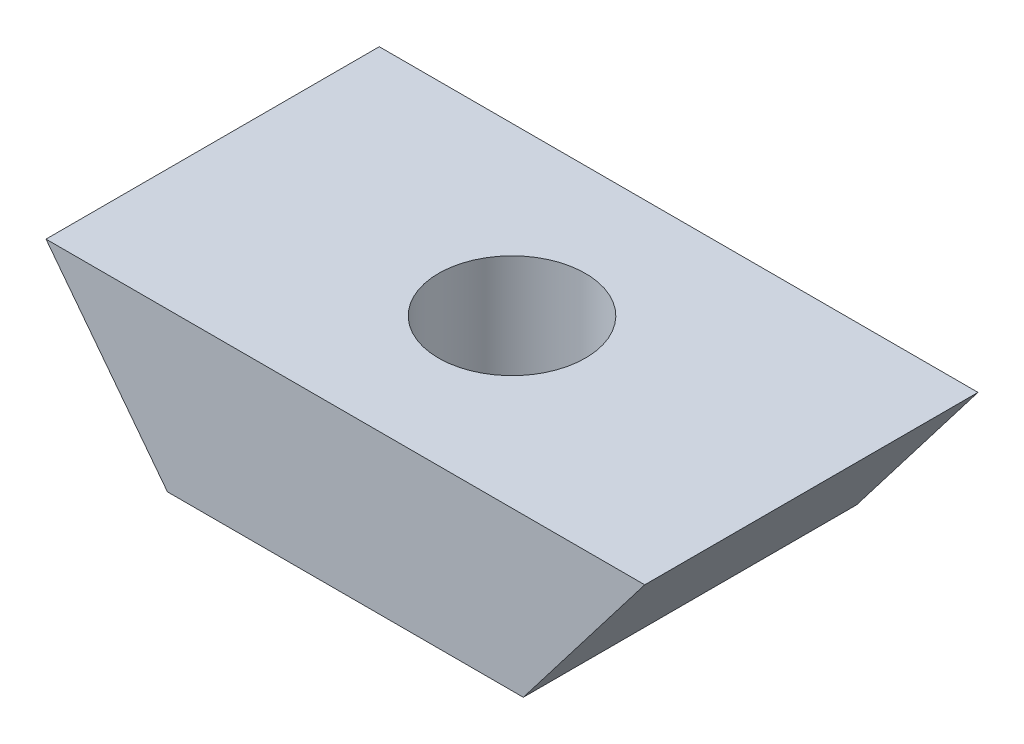
from build123d import *

# Parameters (mm, degrees)
EXTRUDE_1_DEPTH     = 5.9
SKETCH_2_R          = 1.3
CUT_EXTRUDE_1_DEPTH = 5.9


with BuildPart() as part:
    # 草图1 → 凸台-拉伸1 (new body)
    with BuildSketch(Plane.XY):
        Polygon((0, 0), (10.6, 0), (8.45, -2.8), (2.15, -2.8), align=None)
    extrude(amount=EXTRUDE_1_DEPTH)

    # 草图2 → 切除-拉伸1 (cut)
    with BuildSketch(Plane(origin=(0, 0, 0), x_dir=(1, 0, 0), z_dir=(0, 1, 0))):
        with Locations(Location((5.3, -2.95, 0), (0, 0, 270))):
            Circle(SKETCH_2_R)
    extrude(amount=-CUT_EXTRUDE_1_DEPTH, mode=Mode.SUBTRACT)


solid = part.part
